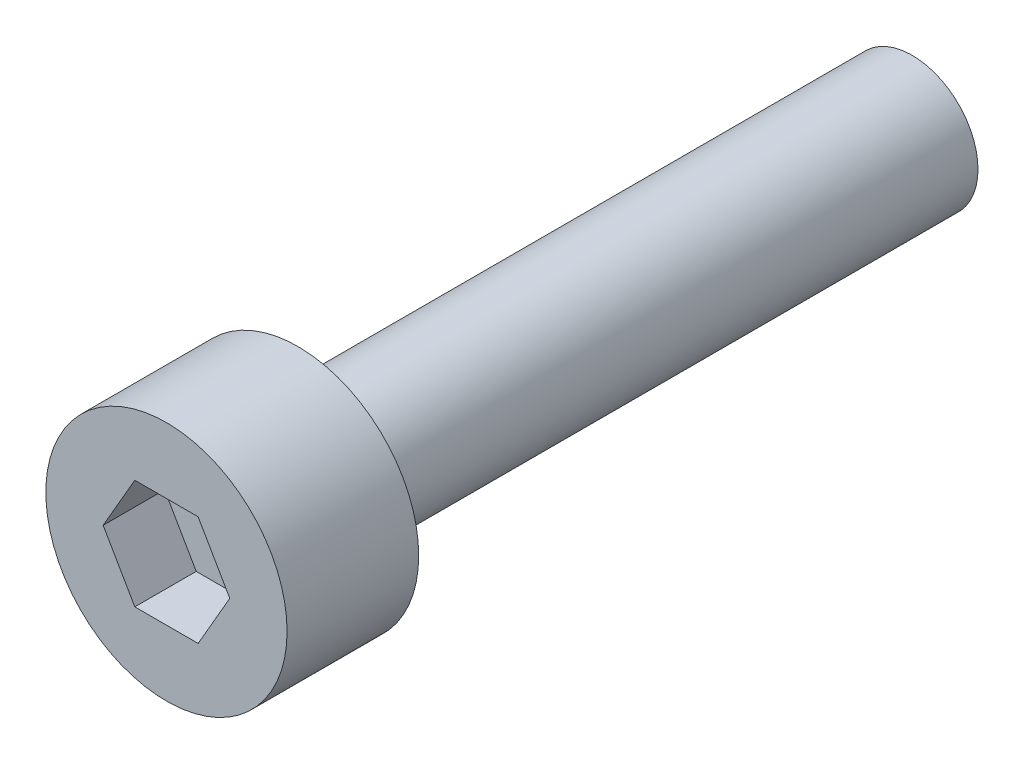
from build123d import *

# Parameters (mm, degrees)
ISO4762_HEAD_D5P5_H3_SKETCH_R       = 2.75
ISO4762_HEAD_D5P5_H3_DEPTH          = 3
M3_MAJOR_DIAMETER_ENVELOPE_START    = -14
M3_MAJOR_DIAMETER_ENVELOPE_SKETCH_R = 1.5
M3_MAJOR_DIAMETER_ENVELOPE_DEPTH    = 14
HEX_SOCKET_2P5AF_START              = 1.6
HEX_SOCKET_2P5AF_DEPTH              = 1.4


with BuildPart() as part:
    # ISO4762_head_D5p5_h3_Sketch → ISO4762_head_D5p5_h3 (new body)
    with BuildSketch(Plane.XY):
        Circle(ISO4762_HEAD_D5P5_H3_SKETCH_R)
    extrude(amount=ISO4762_HEAD_D5P5_H3_DEPTH)

    # M3_major_diameter_envelope_Sketch → M3_major_diameter_envelope (add)
    with BuildSketch(Plane.XY.offset(M3_MAJOR_DIAMETER_ENVELOPE_START)):
        Circle(M3_MAJOR_DIAMETER_ENVELOPE_SKETCH_R)
    extrude(amount=M3_MAJOR_DIAMETER_ENVELOPE_DEPTH)

    # Hex_socket_2p5AF_Sketch → Hex_socket_2p5AF (cut)
    with BuildSketch(Plane.XY.offset(HEX_SOCKET_2P5AF_START)):
        Polygon((1.443375673, 0), (0.721687836, 1.25), (-0.721687836, 1.25), (-1.443375673, 0), (-0.721687836, -1.25), (0.721687836, -1.25), align=None)
    extrude(amount=HEX_SOCKET_2P5AF_DEPTH, mode=Mode.SUBTRACT)


solid = part.part
